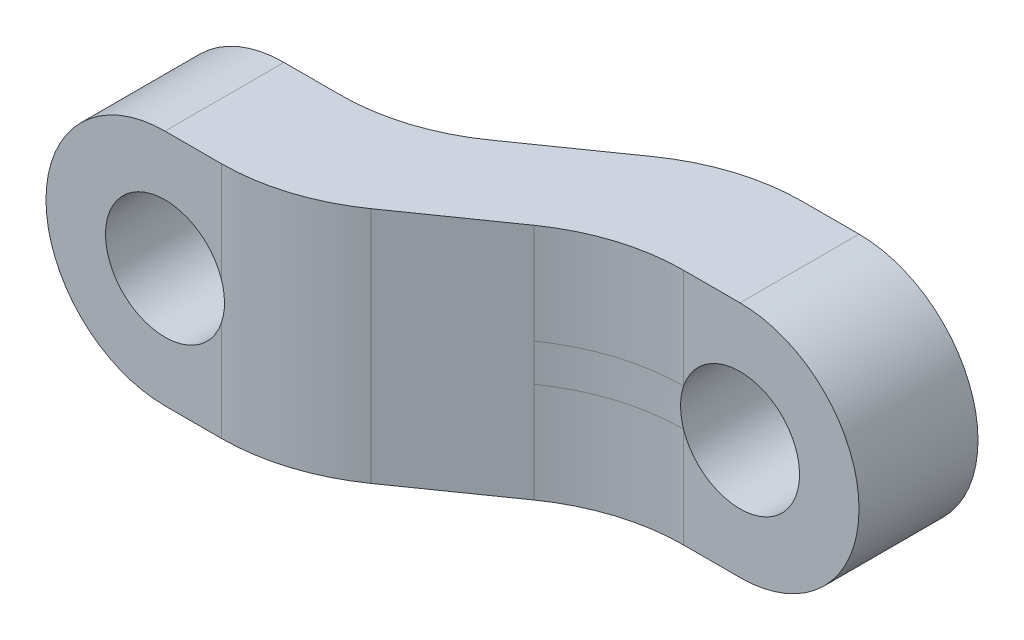
from build123d import *

# Parameters (mm, degrees)
BOSS_EXTRUDE1_DEPTH      = 3
BOSS_EXTRUDE1_DEPTH_BACK = 3
CUT_EXTRUDE1_DEPTH       = 3
CUT_EXTRUDE1_DEPTH_BACK  = 3
SKETCH2_R                = 1.5
CUT_EXTRUDE3_DEPTH       = 3
CUT_EXTRUDE3_DEPTH_BACK  = 3
SKETCH4_R                = 1.5
FILLET1_R                = 5


with BuildPart() as part:
    # Sketch3 → Boss-Extrude1 (new, two sides: drawn at the far end of the back side and taken through both)
    with BuildSketch(Plane(origin=(0, 0, 0), x_dir=(1, 0, 0), z_dir=(0, 1, 0)).offset(-BOSS_EXTRUDE1_DEPTH_BACK)):
        Polygon((-3, 1.5), (-8, -2), (-14, -2), (-14, -5), (-8, -5), (-3, -1.5), (3, -1.5), (3, 1.5), align=None)
    extrude(amount=BOSS_EXTRUDE1_DEPTH + BOSS_EXTRUDE1_DEPTH_BACK)

    # Sketch2 → Cut-Extrude1 (cut, two sides: drawn at the far end of the back side and taken through both)
    with BuildSketch(Plane.XY.offset(-CUT_EXTRUDE1_DEPTH_BACK)):
        with BuildLine():
            ThreePointArc((3, 0), (2.121320338, -2.121320349), (-1.5e-08, -3))
            Line((-1.5e-08, -3), (3, -3))
            Line((3, -3), (3, 0))
        make_face()
        with BuildLine():
            ThreePointArc((0, 3), (2.121320344, 2.121320344), (3, 0))
            Line((3, 0), (3, 3))
            Line((3, 3), (0, 3))
        make_face()
        Circle(SKETCH2_R)
    extrude(amount=CUT_EXTRUDE1_DEPTH + CUT_EXTRUDE1_DEPTH_BACK, mode=Mode.SUBTRACT)

    # Sketch4 → Cut-Extrude3 (cut, two sides: drawn at the far end of the back side and taken through both)
    with BuildSketch(Plane.XY.offset(5).offset(-CUT_EXTRUDE3_DEPTH_BACK)):
        with BuildLine():
            ThreePointArc((-14, 0), (-13.121320344, 2.121320344), (-11, 3))
            Line((-11, 3), (-14, 3))
            Line((-14, 3), (-14, 0))
        make_face()
        with BuildLine():
            ThreePointArc((-11, -3), (-13.121320344, -2.121320344), (-14, 0))
            Line((-14, 0), (-14, -3))
            Line((-14, -3), (-11, -3))
        make_face()
        with Locations((-11, 0)):
            Circle(SKETCH4_R)
    extrude(amount=CUT_EXTRUDE3_DEPTH + CUT_EXTRUDE3_DEPTH_BACK, mode=Mode.SUBTRACT)

    # Fillet1
    fillet1_edges = [part.edges().sort_by_distance(p)[0] for p in [
        (-8, 0, 5),
        (-3, 0, 1.5),
        (-3, 0, -1.5),
        (-8, 0, 2),
    ]]
    fillet(fillet1_edges, radius=FILLET1_R)


solid = part.part
